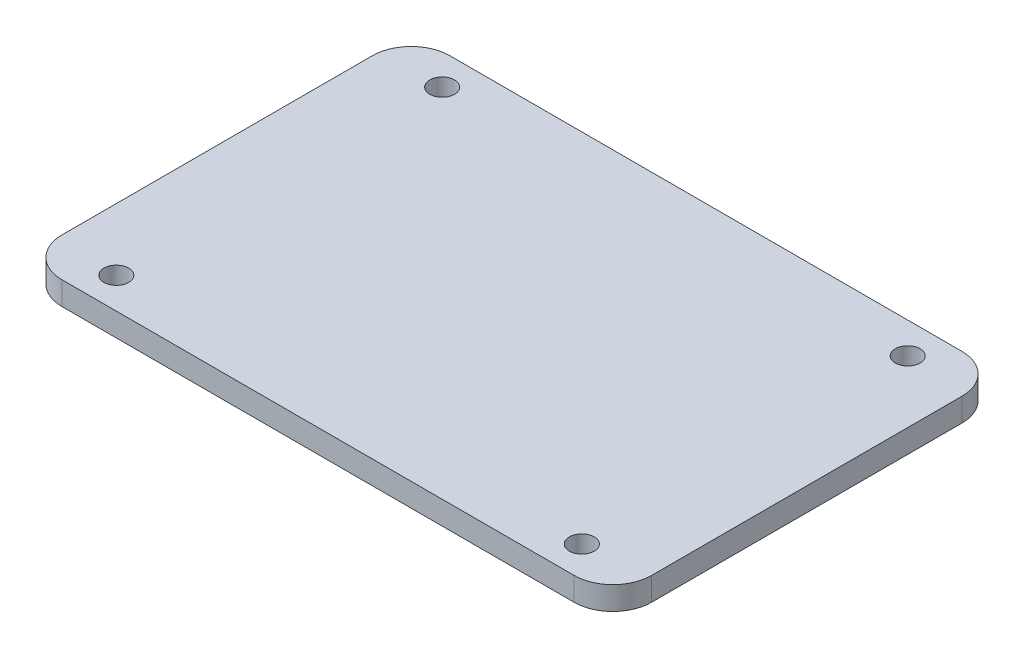
from build123d import *

# Parameters (mm, degrees)
SKETCH1_R           = 1.6
BOSS_EXTRUDE1_DEPTH = 3


with BuildPart() as part:
    # Sketch1 → Boss-Extrude1 (new body)
    with BuildSketch(Plane(origin=(0, 53, 0), x_dir=(1, 0, 0), z_dir=(0, 1, 0))):
        with BuildLine():
            Line((33, 25), (-33, 25))
            ThreePointArc((-33, 25), (-36.535533906, 23.535533906), (-38, 20))
            Line((-38, 20), (-38, -20))
            ThreePointArc((-38, -20), (-36.535533906, -23.535533906), (-33, -25))
            Line((-33, -25), (33, -25))
            ThreePointArc((33, -25), (36.535533906, -23.535533906), (38, -20))
            Line((38, -20), (38, 20))
            ThreePointArc((38, 20), (36.535533906, 23.535533906), (33, 25))
        make_face()
        with Locations(Location((30, 21, 0), (0, 0, 270))):
            Circle(SKETCH1_R, mode=Mode.SUBTRACT)
        with Locations(Location((-30, 21, 0), (0, 0, 270))):
            Circle(SKETCH1_R, mode=Mode.SUBTRACT)
        with Locations(Location((30, -21, 0), (0, 0, 270))):
            Circle(SKETCH1_R, mode=Mode.SUBTRACT)
        with Locations(Location((-30, -21, 0), (0, 0, 270))):
            Circle(SKETCH1_R, mode=Mode.SUBTRACT)
    extrude(amount=BOSS_EXTRUDE1_DEPTH)


solid = part.part
